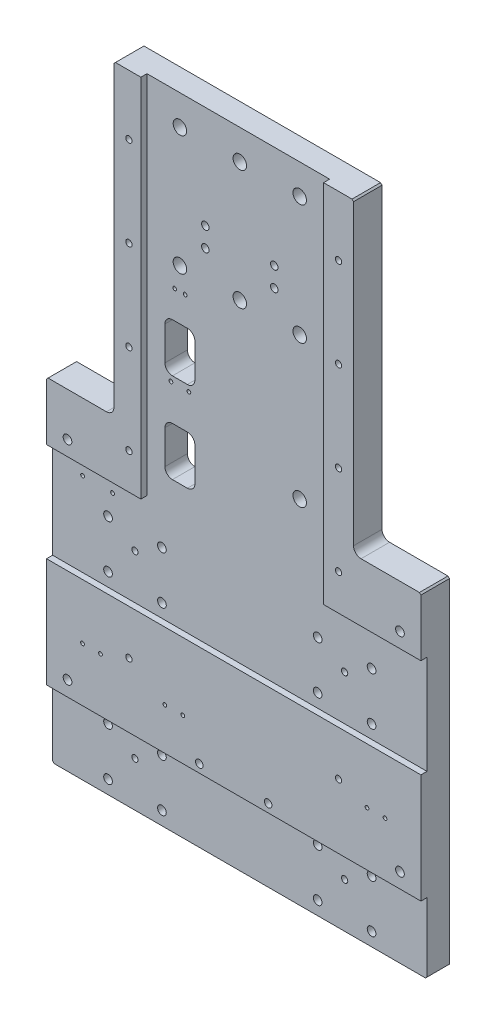
from build123d import *

# Parameters (mm, degrees)
BOSS_EXTRUDE1_DEPTH   = 19.05
SKETCH2_W             = 250
SKETCH2_H             = 47
CUT_EXTRUDE1_DEPTH    = 4.05
M5_CLEARANCE_HOLE2_D  = 5.8
M5_CLEARANCE_HOLE1_D  = 5.8
M5X0_8_TAPPED_HOLE1_D = 4.2
LPATTERN1_COUNT       = 7
LPATTERN1_PITCH       = 60
MIRROR2_COPY_1_D      = 5.8
MIRROR2_COPY_2_D      = 4.2
MIRROR2_COPY_3_D      = 4.2
MIRROR2_COPY_4_D      = 4.2
MIRROR2_COPY_5_D      = 4.2
MIRROR2_COPY_6_D      = 4.2
MIRROR2_COPY_7_D      = 4.2
M8_CLEARANCE_HOLE1_D  = 9
M6X1_0_TAPPED_HOLE2_D = 5
M3X0_5_TAPPED_HOLE3_D = 2.5
M3X0_5_TAPPED_HOLE1_D = 2.5
M3X0_5_TAPPED_HOLE2_D = 2.5
CUT_EXTRUDE2_REACH    = 369.253
M3X0_5_TAPPED_HOLE4_D = 2.5
FILLET1_R             = 5
CHAMFER1_SIZE         = 1


with BuildPart() as part:
    # Sketch1 → Boss-Extrude1 (new body)
    with BuildSketch(Plane.XY):
        Polygon((-125, 140), (-125, -85), (125, -85), (125, 140), (80, 140), (80, 345), (-80, 345), (-80, 140), align=None)
    extrude(amount=BOSS_EXTRUDE1_DEPTH)

    # Sketch2 → Cut-Extrude1 (cut)
    with BuildSketch(Plane.XY.offset(19.05)):
        with Locations((0, -61.5)):
            Rectangle(SKETCH2_W, SKETCH2_H)
        Polygon((-125, 35), (125, 35), (125, 101), (60, 101), (60, 345), (-62, 345), (-62, 101), (-125, 101), align=None)
    extrude(amount=-CUT_EXTRUDE1_DEPTH, mode=Mode.SUBTRACT)

    # M5 Clearance Hole2 (through all)
    with Locations(Plane.XY.offset(15)):
        with Locations((-88, 76), (-52, 76), (-52, 44), (-88, 44)):
            m5_clearance_hole2 = Hole(M5_CLEARANCE_HOLE2_D / 2)

    # Mirror1: M5 Clearance Hole2 across plane
    add(m5_clearance_hole2.mirror(Plane.ZX), mode=Mode.SUBTRACT)

    # M5 Clearance Hole1 (through all)
    with Locations(Plane.XY.offset(19.05)):
        with Locations((-111, 111), (-111, -28)):
            m5_clearance_hole1 = Hole(M5_CLEARANCE_HOLE1_D / 2)

    # M5x0.8 Tapped Hole1 (through all)
    with Locations(Plane.XY.offset(19.05)):
        with Locations((-70, -55)):
            m5x0_8_tapped_hole1 = Hole(M5X0_8_TAPPED_HOLE1_D / 2)

    # LPattern1: M5x0.8 Tapped Hole1 ×7
    with Locations(*[(0, i * LPATTERN1_PITCH, 0) for i in range(1, LPATTERN1_COUNT)]):
        add(m5x0_8_tapped_hole1, mode=Mode.SUBTRACT)

    # Mirror2: M5 Clearance Hole2, M5 Clearance Hole1, M5x0.8 Tapped Hole1 across plane
    add(m5_clearance_hole2.mirror(Plane(origin=(0, 0, 0), x_dir=(0, 0, 1), z_dir=(1, 0, 0))), mode=Mode.SUBTRACT)
    add(m5_clearance_hole1.mirror(Plane(origin=(0, 0, 0), x_dir=(0, 0, 1), z_dir=(1, 0, 0))), mode=Mode.SUBTRACT)
    add(m5x0_8_tapped_hole1.mirror(Plane(origin=(0, 0, 0), x_dir=(0, 0, 1), z_dir=(1, 0, 0))), mode=Mode.SUBTRACT)

    # Mirror2 copy 1 (through all)
    with Locations(Plane(origin=(0, 0, 15), x_dir=(-1, 0, 0), z_dir=(0, 0, 1))):
        with Locations((-88, 76), (-52, 76), (-52, 44), (-88, 44)):
            Hole(MIRROR2_COPY_1_D / 2)

    # Mirror2 copy 2 (through all)
    with Locations(Plane(origin=(0, 60, 19.05), x_dir=(-1, 0, 0), z_dir=(0, 0, 1))):
        with Locations((-70, 55)):
            Hole(MIRROR2_COPY_2_D / 2)

    # Mirror2 copy 3 (through all)
    with Locations(Plane(origin=(0, 120, 19.05), x_dir=(-1, 0, 0), z_dir=(0, 0, 1))):
        with Locations((-70, 55)):
            Hole(MIRROR2_COPY_3_D / 2)

    # Mirror2 copy 4 (through all)
    with Locations(Plane(origin=(0, 180, 19.05), x_dir=(-1, 0, 0), z_dir=(0, 0, 1))):
        with Locations((-70, 55)):
            Hole(MIRROR2_COPY_4_D / 2)

    # Mirror2 copy 5 (through all)
    with Locations(Plane(origin=(0, 240, 19.05), x_dir=(-1, 0, 0), z_dir=(0, 0, 1))):
        with Locations((-70, 55)):
            Hole(MIRROR2_COPY_5_D / 2)

    # Mirror2 copy 6 (through all)
    with Locations(Plane(origin=(0, 300, 19.05), x_dir=(-1, 0, 0), z_dir=(0, 0, 1))):
        with Locations((-70, 55)):
            Hole(MIRROR2_COPY_6_D / 2)

    # Mirror2 copy 7 (through all)
    with Locations(Plane(origin=(0, 360, 19.05), x_dir=(-1, 0, 0), z_dir=(0, 0, 1))):
        with Locations((-70, 55)):
            Hole(MIRROR2_COPY_7_D / 2)

    # M8 Clearance Hole1 (through all)
    with Locations(Plane.XY.offset(15)):
        with Locations((-40, 325), (40, 325), (40, 245), (40, 150), (-40, 245), (0, 325), (0, 245)):
            Hole(M8_CLEARANCE_HOLE1_D / 2)

    # M6x1.0 Tapped Hole2 (through all)
    with Locations(Plane.XY.offset(19.05)):
        with Locations((-23, 276.5), (23, 263.5), (-23, 263.5), (23, 276.5), (-23, -32.5), (23, -32.5)):
            Hole(M6X1_0_TAPPED_HOLE2_D / 2)

    # M3x0.5 Tapped Hole3 (through all)
    with Locations(Plane.XY.offset(19.05)):
        with Locations((-101, -2), (-89, -2), (89, -2), (101, -2)):
            Hole(M3X0_5_TAPPED_HOLE3_D / 2)

    # M3x0.5 Tapped Hole1 (through all)
    with Locations(Plane.XY.offset(15)):
        with Locations((-105, 91), (-85, 91)):
            Hole(M3X0_5_TAPPED_HOLE1_D / 2)

    # M3x0.5 Tapped Hole2 (through all)
    with Locations(Plane(origin=(0, 0, 0), x_dir=(1, 0, 0), z_dir=(0, 0, -1))):
        with Locations((-43.5, -230), (-36.5, -230)):
            Hole(M3X0_5_TAPPED_HOLE2_D / 2)

    # Sketch20 → Cut-Extrude2 (cut, up to next)
    with BuildSketch(Plane.XY.offset(15), mode=Mode.PRIVATE) as cut_extrude2_sk1:
        with BuildLine():
            Line((-50, 206.25), (-50, 183.75))
            ThreePointArc((-50, 183.75), (-48.535533906, 180.214466094), (-45, 178.75))
            Line((-45, 178.75), (-35, 178.75))
            ThreePointArc((-35, 178.75), (-31.464466094, 180.214466094), (-30, 183.75))
            Line((-30, 183.75), (-30, 206.25))
            ThreePointArc((-30, 206.25), (-31.464466094, 209.785533906), (-35, 211.25))
            Line((-35, 211.25), (-45, 211.25))
            ThreePointArc((-45, 211.25), (-48.535533906, 209.785533906), (-50, 206.25))
        make_face()
    cut_extrude2_tool1 = extrude(cut_extrude2_sk1.sketch, amount=-CUT_EXTRUDE2_REACH, mode=Mode.PRIVATE) & part.part
    # Sketch20 → Cut-Extrude2 (cut, up to next)
    with BuildSketch(Plane.XY.offset(15), mode=Mode.PRIVATE) as cut_extrude2_sk2:
        with BuildLine():
            Line((-50, 146.25), (-50, 123.75))
            ThreePointArc((-50, 123.75), (-48.535533906, 120.214466094), (-45, 118.75))
            Line((-45, 118.75), (-35, 118.75))
            ThreePointArc((-35, 118.75), (-31.464466094, 120.214466094), (-30, 123.75))
            Line((-30, 123.75), (-30, 146.25))
            ThreePointArc((-30, 146.25), (-31.464466094, 149.785533906), (-35, 151.25))
            Line((-35, 151.25), (-45, 151.25))
            ThreePointArc((-45, 151.25), (-48.535533906, 149.785533906), (-50, 146.25))
        make_face()
    cut_extrude2_tool2 = extrude(cut_extrude2_sk2.sketch, amount=-CUT_EXTRUDE2_REACH, mode=Mode.PRIVATE) & part.part
    add(cut_extrude2_tool1.solids().sort_by_distance((-40, 195, 15))[0], mode=Mode.SUBTRACT)
    add(cut_extrude2_tool2.solids().sort_by_distance((-40, 135, 15))[0], mode=Mode.SUBTRACT)

    # M3x0.5 Tapped Hole4 (through all)
    with Locations(Plane(origin=(0, 0, 0), x_dir=(-1, 0, 0), z_dir=(0, 0, -1))):
        with Locations((34, 175), (46, 175), (34, -10), (46, -10)):
            Hole(M3X0_5_TAPPED_HOLE4_D / 2)

    # Fillet1
    fillet1_edges = [part.edges().sort_by_distance(p)[0] for p in [
        (-80, 140, 9.525),
        (80, 140, 9.525),
    ]]
    fillet(fillet1_edges, radius=FILLET1_R)

    # Chamfer1
    chamfer1_edges = [part.edges().sort_by_distance(p)[0] for p in [
        (-80, 345, 9.525),
        (80, 345, 9.525),
        (125, 140, 9.525),
        (-125, 140, 9.525),
        (125, -85, 7.5),
        (-125, -85, 7.5),
    ]]
    chamfer(chamfer1_edges, length=CHAMFER1_SIZE)


solid = part.part
